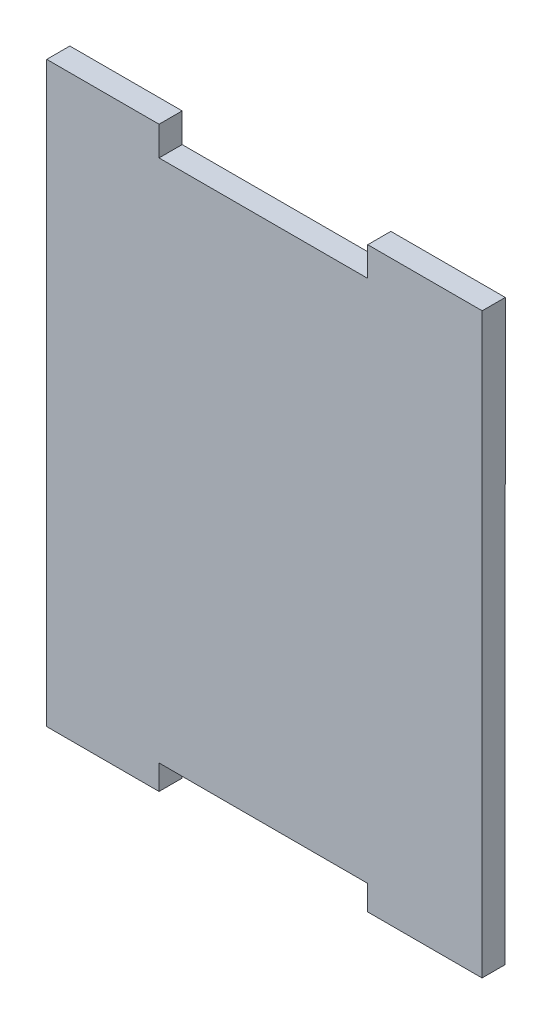
from build123d import *

# Parameters (mm, degrees)
BOSS_EXTRUDE1_DEPTH = 3


with BuildPart() as part:
    # Sketch1 → Boss-Extrude1 (new body)
    with BuildSketch(Plane.XY):
        Polygon((300.870715781, 171.681895433), (327.956209265, 171.68189681), (327.95659988, 175.471909133), (342.806002994, 175.470377229), (342.79305267, 100.47037805), (327.943649557, 100.471909954), (327.943980392, 103.681896334), (300.872358523, 103.681894958), (300.871605208, 100.471894804), (286.29305274, 100.47319122), (286.29305274, 175.473191517), (300.871605208, 175.4718951), align=None)
    extrude(amount=BOSS_EXTRUDE1_DEPTH)


solid = part.part
